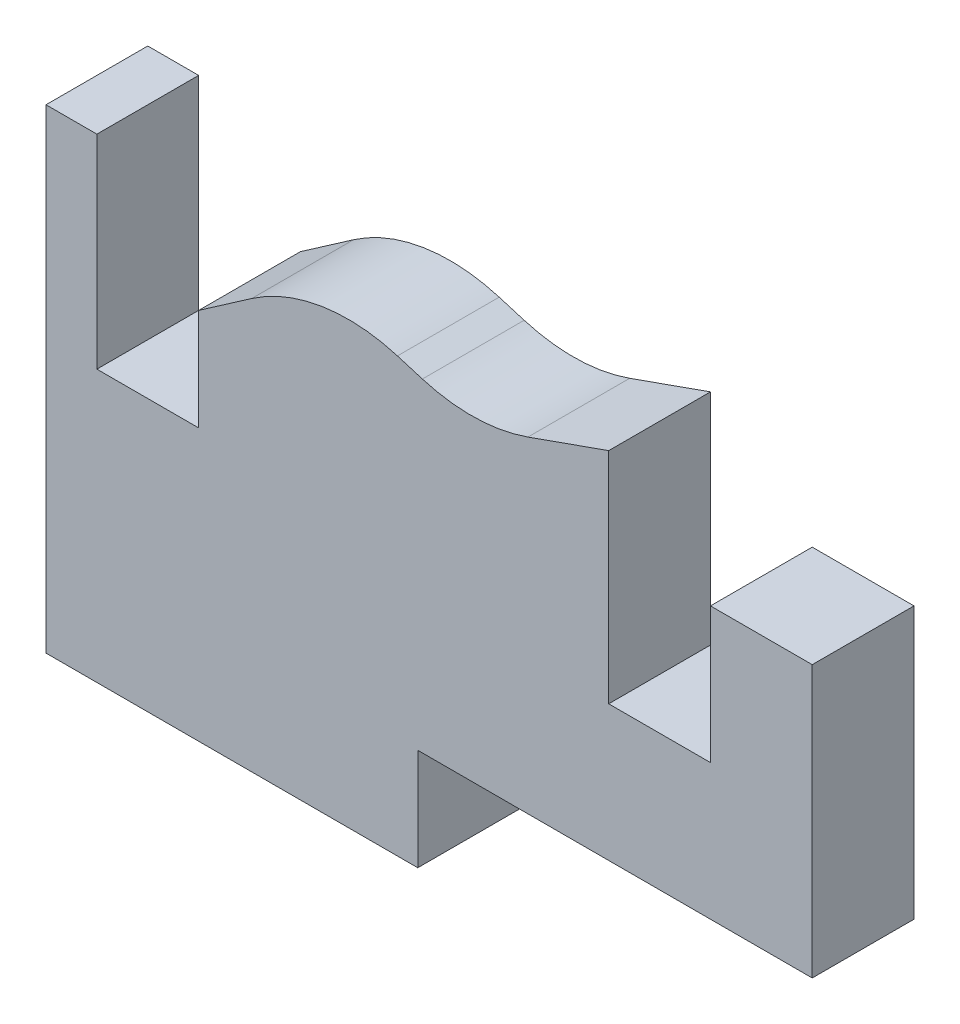
from build123d import *

# Parameters (mm, degrees)
BOSS_EXTRUDE1_DEPTH = 6


with BuildPart() as part:
    # Sketch1 → Boss-Extrude1 (new body)
    with BuildSketch(Plane.XY):
        with BuildLine():
            Line((-18.687702572, 18.729195928), (-15.687702572, 18.729195928))
            Line((-15.687702572, 18.729195928), (-15.687702572, 6.729195928))
            Line((-15.687702572, 6.729195928), (-9.687702572, 6.729195928))
            Line((-9.687702572, 6.729195928), (-9.687702572, 12.729195928))
            Line((-9.687702572, 12.729195928), (-6.556235979, 14.903596974))
            ThreePointArc((-6.556235979, 14.903596974), (-2.418100544, 16.566329788), (2.031378501, 16.264698373))
            Line((2.031378501, 16.264698373), (3.503651069, 15.82124278))
            ThreePointArc((3.503651069, 15.82124278), (6.627191746, 15.399192613), (9.726940979, 15.970320798))
            Line((9.726940979, 15.970320798), (14.488027768, 17.656969749))
            Line((14.488027768, 17.656969749), (14.488027768, 4.729195928))
            Line((14.488027768, 4.729195928), (20.488027768, 4.729195928))
            Line((20.488027768, 4.729195928), (20.488027768, 12.729195928))
            Line((20.488027768, 12.729195928), (26.488027768, 12.729195928))
            Line((26.488027768, 12.729195928), (26.488027768, -3.270804072))
            Line((26.488027768, -3.270804072), (3.231231788, -3.270804072))
            Line((3.231231788, -3.270804072), (3.231231788, -9.270804072))
            Line((3.231231788, -9.270804072), (-18.687702572, -9.270804072))
            Line((-18.687702572, -9.270804072), (-18.687702572, 18.729195928))
        make_face()
    extrude(amount=BOSS_EXTRUDE1_DEPTH)


solid = part.part
